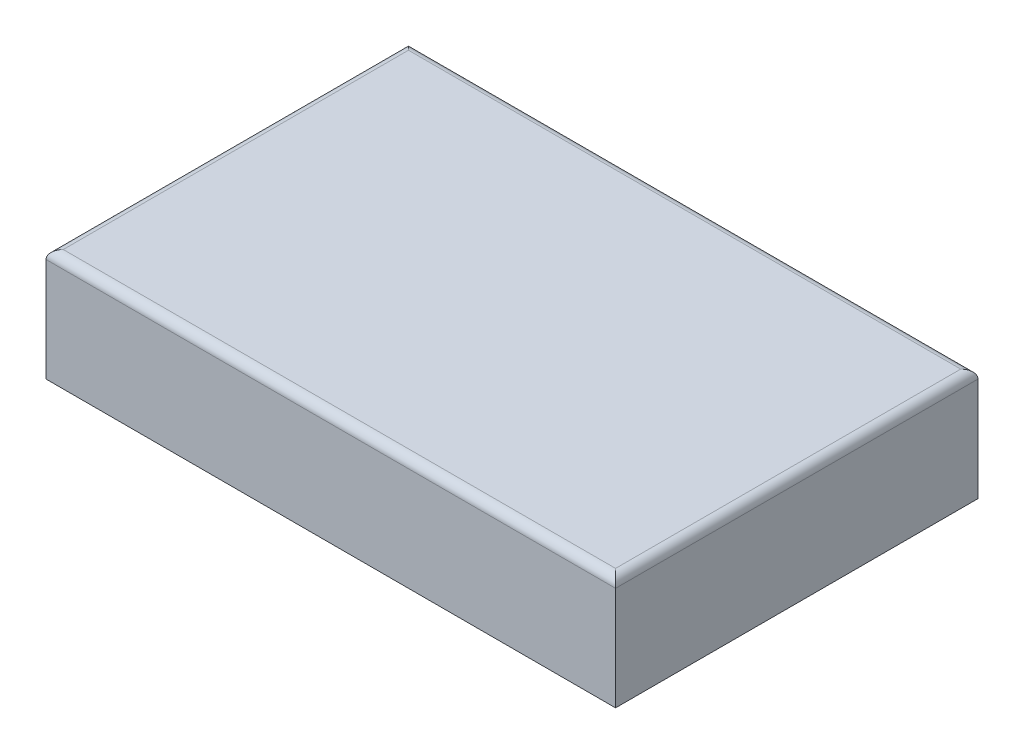
from build123d import *

# Parameters (mm, degrees)
SKETCH1_W           = 66
SKETCH1_H           = 42
SKETCH1_W_2         = 60
SKETCH1_H_2         = 36
BOSS_EXTRUDE1_DEPTH = 10
SKETCH3_W           = 66
SKETCH3_H           = 42
BOSS_EXTRUDE3_DEPTH = 3
FILLET2_R           = 1


with BuildPart() as part:
    # Sketch1 → Boss-Extrude1 (new body)
    with BuildSketch(Plane(origin=(0, 0, 0), x_dir=(1, 0, 0), z_dir=(0, 1, 0))):
        Rectangle(SKETCH1_W, SKETCH1_H)
        Rectangle(SKETCH1_W_2, SKETCH1_H_2, mode=Mode.SUBTRACT)
    extrude(amount=BOSS_EXTRUDE1_DEPTH)

    # Sketch3 → Boss-Extrude3 (add)
    with BuildSketch(Plane(origin=(0, 10, 0), x_dir=(1, 0, 0), z_dir=(0, 1, 0))):
        Rectangle(SKETCH3_W, SKETCH3_H)
    extrude(amount=BOSS_EXTRUDE3_DEPTH)

    # Fillet2
    fillet2_edges = [part.edges().sort_by_distance(p)[0] for p in [
        (-33, 13, 0),
        (0, 13, 21),
        (33, 13, 0),
        (0, 13, -21),
    ]]
    fillet(fillet2_edges, radius=FILLET2_R)


solid = part.part
